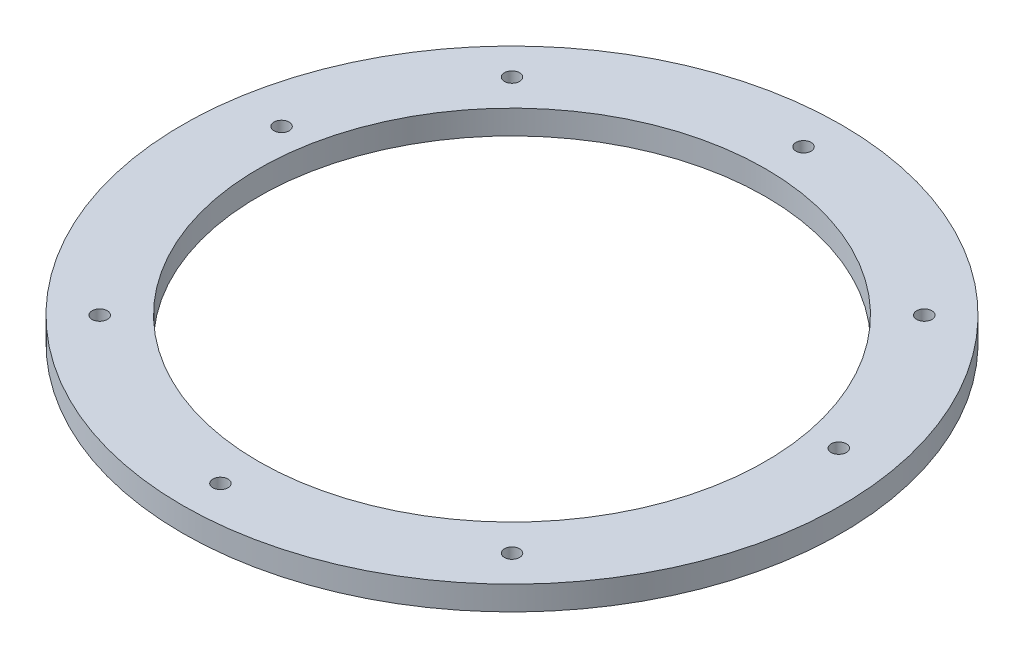
from build123d import *

# Parameters (mm, degrees)
SKETCH1_R           = 65
SKETCH1_R_2         = 50
BOSS_EXTRUDE1_DEPTH = 4.75
SKETCH2_R           = 1.5
CUT_EXTRUDE1_DEPTH  = 5
SKETCH3_R           = 1.5
CUT_EXTRUDE2_DEPTH  = 93.046523563


with BuildPart() as part:
    # Sketch1 → Boss-Extrude1 (new body)
    with BuildSketch(Plane(origin=(0, 0, 0), x_dir=(1, 0, 0), z_dir=(0, 1, 0))):
        Circle(SKETCH1_R)
        Circle(SKETCH1_R_2, mode=Mode.SUBTRACT)
    extrude(amount=BOSS_EXTRUDE1_DEPTH)

    # Sketch2 → Cut-Extrude1 (cut)
    with BuildSketch(Plane(origin=(0, 4.75, 0), x_dir=(1, 0, 0), z_dir=(0, 1, 0))):
        with Locations((40.658639918, 40.658639918)):
            Circle(SKETCH2_R)
        with Locations((40.658639918, -40.658639918)):
            Circle(SKETCH2_R)
        with Locations((0, -57.5)):
            Circle(SKETCH2_R)
        with Locations((-40.658639918, 40.658639918)):
            Circle(SKETCH2_R)
        with Locations((0, 57.5)):
            Circle(SKETCH2_R)
        with Locations((-40.658639918, -40.658639918)):
            Circle(SKETCH2_R)
    extrude(amount=-CUT_EXTRUDE1_DEPTH, mode=Mode.SUBTRACT)

    # Sketch3 → Cut-Extrude2 (cut, through all)
    with BuildSketch(Plane(origin=(0, 4.75, 0), x_dir=(1, 0, 0), z_dir=(0, 1, 0))):
        with Locations((54.951905284, 9.5)):
            Circle(SKETCH3_R)
        with Locations((-54.951905284, 9.5)):
            Circle(SKETCH3_R)
    extrude(amount=-CUT_EXTRUDE2_DEPTH, mode=Mode.SUBTRACT)


solid = part.part
